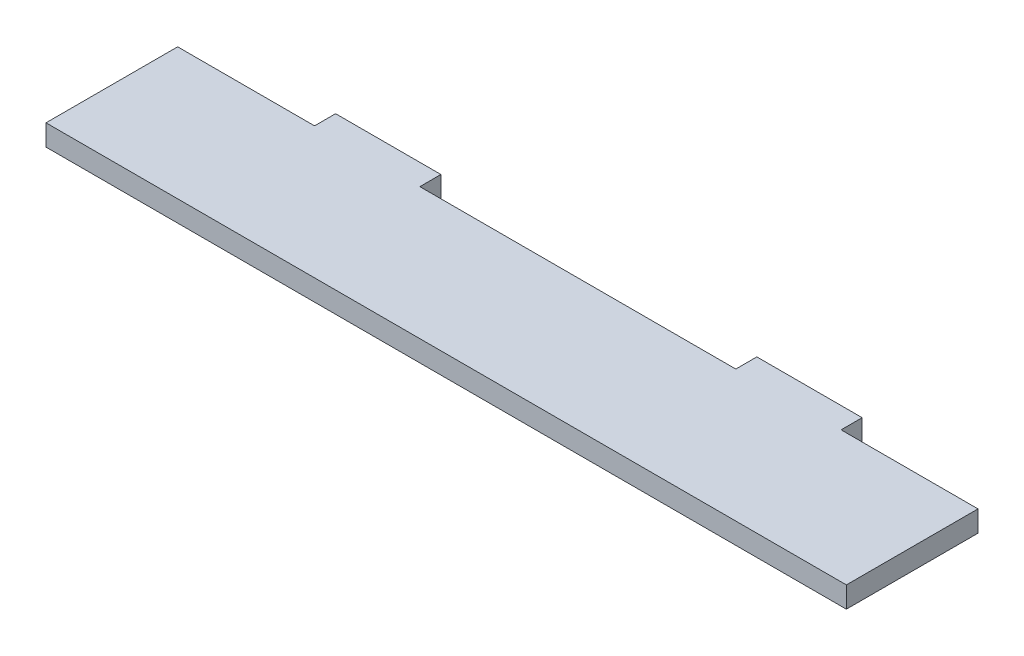
from build123d import *

# Parameters (mm, degrees)
SKETCH1_W           = 193.04
SKETCH1_H           = 5.08
BOSS_EXTRUDE1_DEPTH = 31.75
SKETCH4_W           = 25.4
SKETCH4_H           = 5.08
BOSS_EXTRUDE2_DEPTH = 5.08


with BuildPart() as part:
    # Sketch1 → Boss-Extrude1 (new body)
    with BuildSketch(Plane.XY):
        with Locations((0, 104.14)):
            Rectangle(SKETCH1_W, SKETCH1_H)
    extrude(amount=BOSS_EXTRUDE1_DEPTH)

    # Sketch4 → Boss-Extrude2 (add)
    with BuildSketch(Plane(origin=(0, 0, 0), x_dir=(-1, 0, 0), z_dir=(0, 0, -1))):
        with Locations((50.8, 104.14)):
            Rectangle(SKETCH4_W, SKETCH4_H)
        with Locations((-50.8, 104.14)):
            Rectangle(SKETCH4_W, SKETCH4_H)
    extrude(amount=BOSS_EXTRUDE2_DEPTH)


solid = part.part
